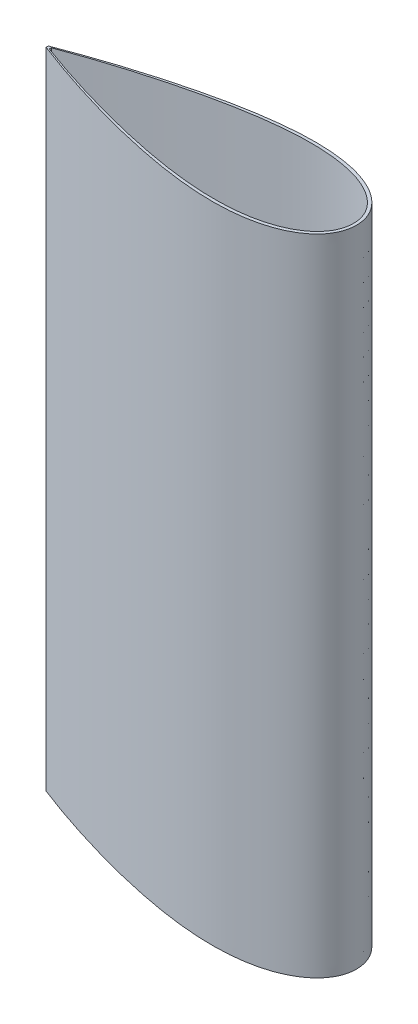
from build123d import *

# Parameters (mm, degrees)
BOSS_EXTRUDE1_DEPTH     = 170
CUT_EXTRUDE1_DEPTH      = 180.854730216
CUT_EXTRUDE1_DEPTH_BACK = 180.854730216


with BuildPart() as part:
    # Sketch1 → Boss-Extrude1 (new body)
    with BuildSketch(Plane(origin=(0, 0, 0), x_dir=(1, 0, 0), z_dir=(0, 1, 0))):
        with BuildLine():
            Line((-57.12, 0.28557144), (-57.12, -0.28557144))
            add(Edge.make_bspline(
                [(-57.12, 0.28557144), (-57.045504044, 0.314572746), (-56.748532331, 0.430183953), (-56.083436953, 0.687126259), (-54.98302006, 1.106766885), (-53.459184099, 1.676523506), (-51.528550664, 2.380272674), (-49.212177735, 3.198993693), (-46.535400167, 4.111835748), (-43.527538558, 5.096813059), (-40.221580751, 6.131289203), (-36.65380238, 7.192115627), (-32.863345924, 8.255494879), (-28.891761905, 9.296664774), (-24.782522337, 10.289563982), (-20.580515737, 11.206654449), (-16.331534659, 12.019060841), (-12.081767191, 12.69713645), (-7.87730333, 13.211489437), (-3.763664102, 13.534415398), (0.214644948, 13.64159735), (4.014563956, 13.513865269), (7.594911886, 13.138762831), (10.916848411, 12.511652403), (13.94437884, 11.636099612), (16.644868805, 10.5233265), (18.989424566, 9.190612202), (20.952825012, 7.658778157), (22.512507051, 5.949299348), (23.646649454, 4.082924064), (24.3333703, 2.080718388), (24.553411985, 0), (24.3333703, -2.080718388), (23.646649454, -4.082924064), (22.512507051, -5.949299348), (20.952825012, -7.658778157), (18.989424566, -9.190612202), (16.644868805, -10.5233265), (13.94437884, -11.636099612), (10.916848411, -12.511652403), (7.594911886, -13.138762831), (4.014563956, -13.513865269), (0.214644948, -13.64159735), (-3.763664102, -13.534415398), (-7.87730333, -13.211489437), (-12.081767191, -12.69713645), (-16.331534659, -12.019060841), (-20.580515737, -11.206654449), (-24.782522337, -10.289563982), (-28.891761905, -9.296664774), (-32.863345924, -8.255494879), (-36.65380238, -7.192115627), (-40.221580751, -6.131289203), (-43.527538558, -5.096813059), (-46.535400167, -4.111835748), (-49.212177735, -3.198993693), (-51.528550664, -2.380272674), (-53.459184099, -1.676523506), (-54.98302006, -1.106766885), (-56.083436953, -0.687126259), (-56.748532331, -0.430183953), (-57.045504044, -0.314572746), (-57.12, -0.28557144)],
                knots=[0, 0, 0, 0, 0.001335505, 0.005323874, 0.011911321, 0.021010244, 0.032501944, 0.046239823, 0.062052667, 0.079747678, 0.099113128, 0.119920646, 0.141927325, 0.16487798, 0.188507904, 0.212546489, 0.236721965, 0.260767353, 0.284427458, 0.30746646, 0.329675366, 0.350878491, 0.370938189, 0.389757543, 0.407281472, 0.423497743, 0.438440369, 0.452198294, 0.46493114, 0.476889606, 0.488429494, 0.5, 0.511570506, 0.523110394, 0.53506886, 0.547801706, 0.561559631, 0.576502257, 0.592718528, 0.610242457, 0.629061811, 0.649121509, 0.670324634, 0.69253354, 0.715572542, 0.739232647, 0.763278035, 0.787453511, 0.811492096, 0.83512202, 0.858072675, 0.880079354, 0.900886872, 0.920252322, 0.937947333, 0.953760177, 0.967498056, 0.978989756, 0.988088679, 0.994676126, 0.998664495, 1, 1, 1, 1], degree=3))
        make_face()
    extrude(amount=BOSS_EXTRUDE1_DEPTH)

    # Sketch2 → Cut-Extrude1 (cut, two sides: drawn at the far end of the back side and taken through both)
    with BuildSketch(Plane(origin=(0, 0, 0), x_dir=(1, 0, 0), z_dir=(0, 1, 0)).offset(-CUT_EXTRUDE1_DEPTH_BACK)):
        with BuildLine():
            Line((-56.32, 0.2688), (-56.32, -0.2688))
            add(Edge.make_bspline(
                [(-56.32, 0.2688), (-56.246964327, 0.296098233), (-55.955800717, 0.404925219), (-55.303710206, 0.646790768), (-54.22481147, 1.041807165), (-52.730784194, 1.578126428), (-50.837929542, 2.240569543), (-48.566899677, 3.011230004), (-45.942536526, 3.870480147), (-42.993587092, 4.797625005), (-39.752390893, 5.771358103), (-36.254509088, 6.769891237), (-32.538313425, 7.7708251), (-28.644538635, 8.750851362), (-24.615807826, 9.685437472), (-20.496139759, 10.548659503), (-16.330448299, 11.313334133), (-12.164044756, 11.951553142), (-8.042153063, 12.435652539), (-4.009444683, 12.739565466), (-0.109594078, 12.840427415), (3.615153305, 12.72023663), (7.124418478, 12.367330009), (10.380155078, 11.777419309), (13.34715698, 10.95394257), (15.993578076, 9.907529168), (18.29133054, 8.65444961), (20.21604872, 7.214144931), (21.746035774, 5.606300031), (22.860005573, 3.849419877), (23.535542952, 1.962380003), (23.752183398, 0), (23.535542952, -1.962380003), (22.860005573, -3.849419877), (21.746035774, -5.606300031), (20.21604872, -7.214144931), (18.29133054, -8.65444961), (15.993578076, -9.907529168), (13.34715698, -10.95394257), (10.380155078, -11.777419309), (7.124418478, -12.367330009), (3.615153305, -12.72023663), (-0.109594078, -12.840427415), (-4.009444683, -12.739565466), (-8.042153063, -12.435652539), (-12.164044756, -11.951553142), (-16.330448299, -11.313334133), (-20.496139759, -10.548659503), (-24.615807826, -9.685437472), (-28.644538635, -8.750851362), (-32.538313425, -7.7708251), (-36.254509088, -6.769891237), (-39.752390893, -5.771358103), (-42.993587092, -4.797625005), (-45.942536526, -3.870480147), (-48.566899677, -3.011230004), (-50.837929542, -2.240569543), (-52.730784194, -1.578126428), (-54.22481147, -1.041807165), (-55.303710206, -0.646790768), (-55.955800717, -0.404925219), (-56.246964327, -0.296098233), (-56.32, -0.2688)],
                knots=[0, 0, 0, 0, 0.001336117, 0.005326556, 0.011918196, 0.021024447, 0.032527838, 0.046283073, 0.062120187, 0.079847486, 0.09925415, 0.120112509, 0.142180173, 0.165202311, 0.188914406, 0.213045822, 0.237324417, 0.26148228, 0.285262439, 0.308426097, 0.330759759, 0.352081437, 0.372245301, 0.391144495, 0.408712655, 0.424925603, 0.439805693, 0.453431792, 0.46595701, 0.477632115, 0.488823045, 0.5, 0.511176955, 0.522367885, 0.53404299, 0.546568208, 0.560194307, 0.575074397, 0.591287345, 0.608855505, 0.627754699, 0.647918563, 0.669240241, 0.691573903, 0.714737561, 0.73851772, 0.762675583, 0.786954178, 0.811085594, 0.834797689, 0.857819827, 0.879887491, 0.90074585, 0.920152514, 0.937879813, 0.953716927, 0.967472162, 0.978975553, 0.988081804, 0.994673444, 0.998663883, 1, 1, 1, 1], degree=3))
        make_face()
    extrude(amount=CUT_EXTRUDE1_DEPTH + CUT_EXTRUDE1_DEPTH_BACK, mode=Mode.SUBTRACT)


solid = part.part
